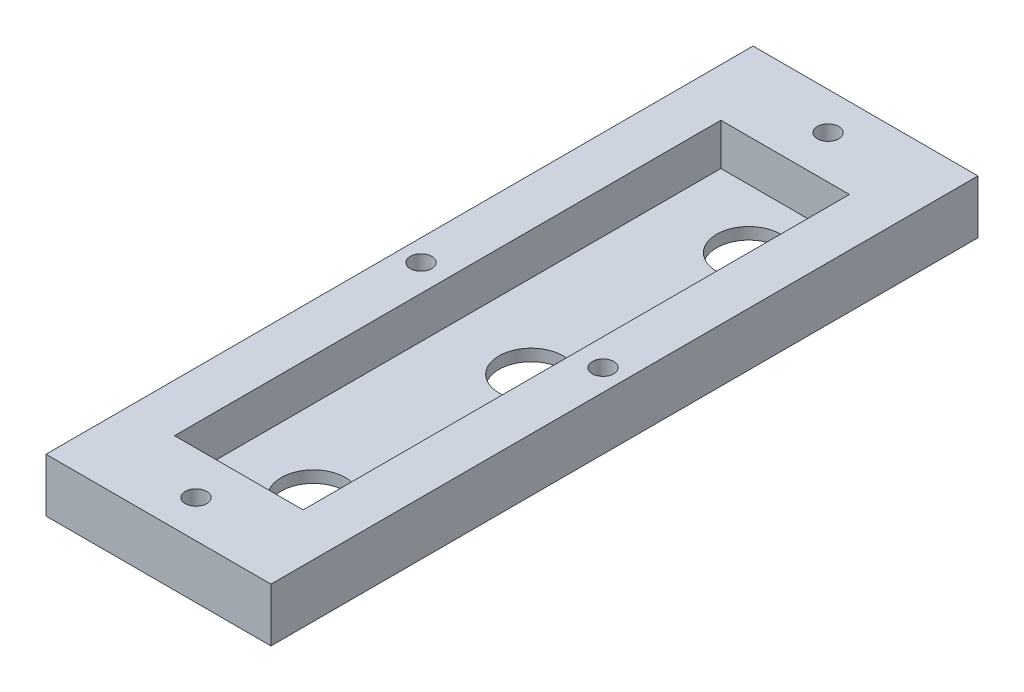
from build123d import *

# Parameters (mm, degrees)
SKETCH_1_W          = 21
SKETCH_1_H          = 66
EXTRUDE_1_DEPTH     = 1.1
SKETCH_2_R          = 3
CUT_EXTRUDE_1_DEPTH = 35.647655043
SKETCH_3_W          = 21
SKETCH_3_H          = 66
SKETCH_3_W_2        = 12
SKETCH_3_H_2        = 51
EXTRUDE_2_DEPTH     = 3.9
SKETCH_4_R          = 1.9
SKETCH_4_R_2        = 1
CUT_EXTRUDE_2_DEPTH = 3
SKETCH_4_2_R        = 1
CUT_EXTRUDE_3_DEPTH = 35.989284074


with BuildPart() as part:
    # 草图1 → 凸台-拉伸1 (new body)
    with BuildSketch(Plane(origin=(0, 0, 0), x_dir=(1, 0, 0), z_dir=(0, 1, 0))):
        Rectangle(SKETCH_1_W, SKETCH_1_H)
    extrude(amount=EXTRUDE_1_DEPTH)

    # 草图2 → 切除-拉伸1 (cut, through all)
    with BuildSketch(Plane(origin=(0, 0, 0), x_dir=(-1, 0, 0), z_dir=(0, -1, 0))):
        with Locations(Location((-1.458325738, -20.003345868, 0), (0, 0, 90))):
            Circle(SKETCH_2_R)
        with Locations(Location((-1.786068296, -0.006031428, 0), (0, 0, 90))):
            Circle(SKETCH_2_R)
        with Locations(Location((-2.113810854, 19.991283012, 0), (0, 0, 90))):
            Circle(SKETCH_2_R)
    extrude(amount=-CUT_EXTRUDE_1_DEPTH, mode=Mode.SUBTRACT)

    # 草图3 → 凸台-拉伸2 (add)
    with BuildSketch(Plane(origin=(0, 1.1, 0), x_dir=(1, 0, 0), z_dir=(0, 1, 0))):
        Rectangle(SKETCH_3_W, SKETCH_3_H)
        Rectangle(SKETCH_3_W_2, SKETCH_3_H_2, mode=Mode.SUBTRACT)
    extrude(amount=EXTRUDE_2_DEPTH)

    # 草图4 → 切除-拉伸2 (cut)
    # profile 1 of 4: a face of its own
    with BuildSketch(Plane.XZ):
        with Locations(Location((0, 29.5, 0), (0, 0, 270))):
            Circle(SKETCH_4_R)
        with Locations(Location((0, 29.5, 0), (0, 0, 270))):
            Circle(SKETCH_4_R_2, mode=Mode.SUBTRACT)
    # profile 2 of 4: a face of its own
    with BuildSketch(Plane.XZ):
        with Locations(Location((-8.5, 0, 0), (0, 0, 270))):
            Circle(SKETCH_4_R)
        with Locations(Location((-8.5, 0, 0), (0, 0, 270))):
            Circle(SKETCH_4_R_2, mode=Mode.SUBTRACT)
    # profile 3 of 4: a face of its own
    with BuildSketch(Plane.XZ):
        with Locations(Location((8.5, 0, 0), (0, 0, 270))):
            Circle(SKETCH_4_R)
        with Locations(Location((8.5, 0, 0), (0, 0, 270))):
            Circle(SKETCH_4_R_2, mode=Mode.SUBTRACT)
    # profile 4 of 4: a face of its own
    with BuildSketch(Plane.XZ):
        with Locations(Location((0, -29.5, 0), (0, 0, 270))):
            Circle(SKETCH_4_R)
        with Locations(Location((0, -29.5, 0), (0, 0, 270))):
            Circle(SKETCH_4_R_2, mode=Mode.SUBTRACT)
    extrude(amount=-CUT_EXTRUDE_2_DEPTH, mode=Mode.SUBTRACT)

    # 草图4<2> → 切除-拉伸3 (cut, through all)
    with BuildSketch(Plane.XZ):
        with Locations(Location((-8.5, 0, 0), (0, 0, 270))):
            Circle(SKETCH_4_2_R)
        with Locations(Location((8.5, 0, 0), (0, 0, 270))):
            Circle(SKETCH_4_2_R)
        with Locations(Location((0, 29.5, 0), (0, 0, 270))):
            Circle(SKETCH_4_2_R)
        with Locations(Location((0, -29.5, 0), (0, 0, 270))):
            Circle(SKETCH_4_2_R)
    extrude(amount=-CUT_EXTRUDE_3_DEPTH, mode=Mode.SUBTRACT)


solid = part.part
